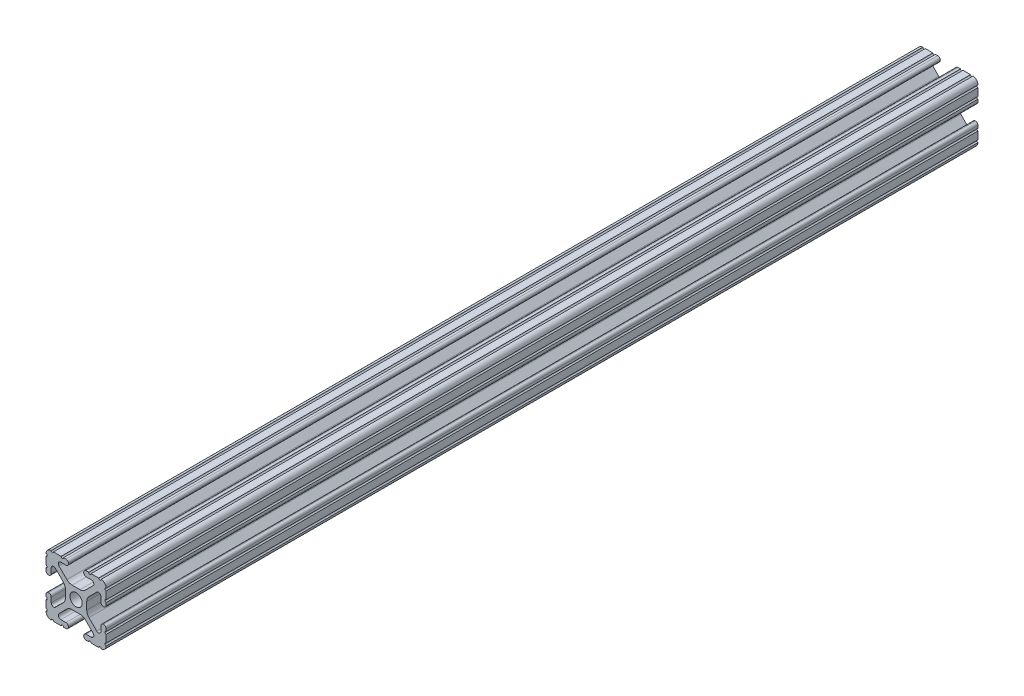
from build123d import *

# Parameters (mm, degrees)
SKETCH1_R           = 2.6035
BOSS_EXTRUDE1_DEPTH = 184.15


with BuildPart() as part:
    # Sketch1 → Boss-Extrude1 (new, symmetric)
    with BuildSketch(Plane.XY):
        with BuildLine():
            Line((-7.179650497, -8.645192506), (-3.952270251, -5.423690499))
            ThreePointArc((-3.952270251, -5.423690499), (-2.922936451, -4.736929036), (-1.709253557, -4.4958))
            Line((-1.709253557, -4.4958), (1.709253557, -4.4958))
            ThreePointArc((1.709253557, -4.4958), (2.922936451, -4.736929036), (3.952270251, -5.423690499))
            Line((3.952270251, -5.423690499), (7.179650497, -8.645192506))
            ThreePointArc((7.179650497, -8.645192506), (7.41473083, -9.822813117), (6.416408329, -10.4902))
            Line((6.416408329, -10.4902), (4.287512407, -10.4902))
            ThreePointArc((4.287512407, -10.4902), (3.54574862, -10.79744862), (3.2385, -11.539212407))
            Line((3.2385, -11.539212407), (3.2385, -11.650987593))
            ThreePointArc((3.2385, -11.650987593), (3.54574862, -12.39275138), (4.287512407, -12.7))
            Line((4.287512407, -12.7), (5.317126718, -12.7))
            ThreePointArc((5.317126718, -12.7), (5.825126718, -12.192), (6.333126718, -12.7))
            Line((6.333126718, -12.7), (9.550443118, -12.7))
            ThreePointArc((9.550443118, -12.7), (10.058366869, -12.192000006), (10.566443095, -12.699847501))
            ThreePointArc((10.566443095, -12.699847501), (12.082537762, -12.08250727), (12.699846982, -10.566399977))
            ThreePointArc((12.699846982, -10.566399977), (12.192000006, -10.058323491), (12.7, -9.5504))
            Line((12.7, -9.5504), (12.7, -6.3330836))
            ThreePointArc((12.7, -6.3330836), (12.192, -5.8250836), (12.7, -5.3170836))
            Line((12.7, -5.3170836), (12.7, -4.287469289))
            ThreePointArc((12.7, -4.287469289), (12.39275138, -3.545705502), (11.650987593, -3.238456882))
            Line((11.650987593, -3.238456882), (11.539212407, -3.238456882))
            ThreePointArc((11.539212407, -3.238456882), (10.79744862, -3.545705502), (10.4902, -4.287469289))
            Line((10.4902, -4.287469289), (10.4902, -6.402089023))
            ThreePointArc((10.4902, -6.402089023), (9.856505071, -7.351067942), (8.737131347, -7.129408934))
            Line((8.737131347, -7.129408934), (5.441005833, -3.840816462))
            ThreePointArc((5.441005833, -3.840816462), (4.750877967, -2.809883091), (4.5085, -1.593185507))
            Line((4.5085, -1.593185507), (4.5085, 1.593185507))
            ThreePointArc((4.5085, 1.593185507), (4.750877967, 2.809883091), (5.441005833, 3.840816462))
            Line((5.441005833, 3.840816462), (8.737131347, 7.129408934))
            ThreePointArc((8.737131347, 7.129408934), (9.856505071, 7.351067942), (10.4902, 6.402089023))
            Line((10.4902, 6.402089023), (10.4902, 4.287469289))
            ThreePointArc((10.4902, 4.287469289), (10.79744862, 3.545705502), (11.539212407, 3.238456882))
            Line((11.539212407, 3.238456882), (11.650987593, 3.238456882))
            ThreePointArc((11.650987593, 3.238456882), (12.39275138, 3.545705502), (12.7, 4.287469289))
            Line((12.7, 4.287469289), (12.7, 5.3170836))
            ThreePointArc((12.7, 5.3170836), (12.192, 5.8250836), (12.7, 6.3330836))
            Line((12.7, 6.3330836), (12.7, 9.5504))
            ThreePointArc((12.7, 9.5504), (12.192000006, 10.058323491), (12.699846982, 10.566399977))
            ThreePointArc((12.699846982, 10.566399977), (12.082537762, 12.08250727), (10.566443095, 12.699847501))
            ThreePointArc((10.566443095, 12.699847501), (10.058366869, 12.192000006), (9.550443118, 12.7))
            Line((9.550443118, 12.7), (6.333126718, 12.7))
            ThreePointArc((6.333126718, 12.7), (5.825126718, 12.192), (5.317126718, 12.7))
            Line((5.317126718, 12.7), (4.287512407, 12.7))
            ThreePointArc((4.287512407, 12.7), (3.54574862, 12.39275138), (3.2385, 11.650987593))
            Line((3.2385, 11.650987593), (3.2385, 11.539212407))
            ThreePointArc((3.2385, 11.539212407), (3.54574862, 10.79744862), (4.287512407, 10.4902))
            Line((4.287512407, 10.4902), (6.476788598, 10.4902))
            ThreePointArc((6.476788598, 10.4902), (7.432222385, 9.85140422), (7.207036008, 8.724370562))
            Line((7.207036008, 8.724370562), (3.898272566, 5.423169045))
            ThreePointArc((3.898272566, 5.423169045), (2.869120213, 4.736787962), (1.655778399, 4.4958))
            Line((1.655778399, 4.4958), (-1.655778399, 4.4958))
            ThreePointArc((-1.655778399, 4.4958), (-2.869120213, 4.736787962), (-3.898272566, 5.423169045))
            Line((-3.898272566, 5.423169045), (-7.207036008, 8.724370562))
            ThreePointArc((-7.207036008, 8.724370562), (-7.432222385, 9.85140422), (-6.476788598, 10.4902))
            Line((-6.476788598, 10.4902), (-4.287512407, 10.4902))
            ThreePointArc((-4.287512407, 10.4902), (-3.54574862, 10.79744862), (-3.2385, 11.539212407))
            Line((-3.2385, 11.539212407), (-3.2385, 11.650987593))
            ThreePointArc((-3.2385, 11.650987593), (-3.54574862, 12.39275138), (-4.287512407, 12.7))
            Line((-4.287512407, 12.7), (-5.317126718, 12.7))
            ThreePointArc((-5.317126718, 12.7), (-5.825126718, 12.192), (-6.333126718, 12.7))
            Line((-6.333126718, 12.7), (-9.550443118, 12.7))
            ThreePointArc((-9.550443118, 12.7), (-10.058366869, 12.192000006), (-10.566443095, 12.699847501))
            ThreePointArc((-10.566443095, 12.699847501), (-12.082537762, 12.08250727), (-12.699846982, 10.566399977))
            ThreePointArc((-12.699846982, 10.566399977), (-12.192000006, 10.058323491), (-12.7, 9.5504))
            Line((-12.7, 9.5504), (-12.7, 6.3330836))
            ThreePointArc((-12.7, 6.3330836), (-12.192, 5.8250836), (-12.7, 5.3170836))
            Line((-12.7, 5.3170836), (-12.7, 4.287469289))
            ThreePointArc((-12.7, 4.287469289), (-12.39275138, 3.545705502), (-11.650987593, 3.238456882))
            Line((-11.650987593, 3.238456882), (-11.539212407, 3.238456882))
            ThreePointArc((-11.539212407, 3.238456882), (-10.79744862, 3.545705502), (-10.4902, 4.287469289))
            Line((-10.4902, 4.287469289), (-10.4902, 6.402089023))
            ThreePointArc((-10.4902, 6.402089023), (-9.856505071, 7.351067942), (-8.737131347, 7.129408934))
            Line((-8.737131347, 7.129408934), (-5.441005833, 3.840816462))
            ThreePointArc((-5.441005833, 3.840816462), (-4.750877967, 2.809883091), (-4.5085, 1.593185507))
            Line((-4.5085, 1.593185507), (-4.5085, -1.593185507))
            ThreePointArc((-4.5085, -1.593185507), (-4.750877967, -2.809883091), (-5.441005833, -3.840816462))
            Line((-5.441005833, -3.840816462), (-8.737131347, -7.129408934))
            ThreePointArc((-8.737131347, -7.129408934), (-9.856505071, -7.351067942), (-10.4902, -6.402089023))
            Line((-10.4902, -6.402089023), (-10.4902, -4.287469289))
            ThreePointArc((-10.4902, -4.287469289), (-10.79744862, -3.545705502), (-11.539212407, -3.238456882))
            Line((-11.539212407, -3.238456882), (-11.650987593, -3.238456882))
            ThreePointArc((-11.650987593, -3.238456882), (-12.39275138, -3.545705502), (-12.7, -4.287469289))
            Line((-12.7, -4.287469289), (-12.7, -5.3170836))
            ThreePointArc((-12.7, -5.3170836), (-12.192, -5.8250836), (-12.7, -6.3330836))
            Line((-12.7, -6.3330836), (-12.7, -9.5504))
            ThreePointArc((-12.7, -9.5504), (-12.192000006, -10.058323491), (-12.699846982, -10.566399977))
            ThreePointArc((-12.699846982, -10.566399977), (-12.082537762, -12.08250727), (-10.566443095, -12.699847501))
            ThreePointArc((-10.566443095, -12.699847501), (-10.058366869, -12.192000006), (-9.550443118, -12.7))
            Line((-9.550443118, -12.7), (-6.333126718, -12.7))
            ThreePointArc((-6.333126718, -12.7), (-5.825126718, -12.192), (-5.317126718, -12.7))
            Line((-5.317126718, -12.7), (-4.287512407, -12.7))
            ThreePointArc((-4.287512407, -12.7), (-3.54574862, -12.39275138), (-3.2385, -11.650987593))
            Line((-3.2385, -11.650987593), (-3.2385, -11.539212407))
            ThreePointArc((-3.2385, -11.539212407), (-3.54574862, -10.79744862), (-4.287512407, -10.4902))
            Line((-4.287512407, -10.4902), (-6.416408329, -10.4902))
            ThreePointArc((-6.416408329, -10.4902), (-7.41473083, -9.822813117), (-7.179650497, -8.645192506))
        make_face()
        Circle(SKETCH1_R, mode=Mode.SUBTRACT)
    extrude(amount=BOSS_EXTRUDE1_DEPTH, both=True)


solid = part.part
